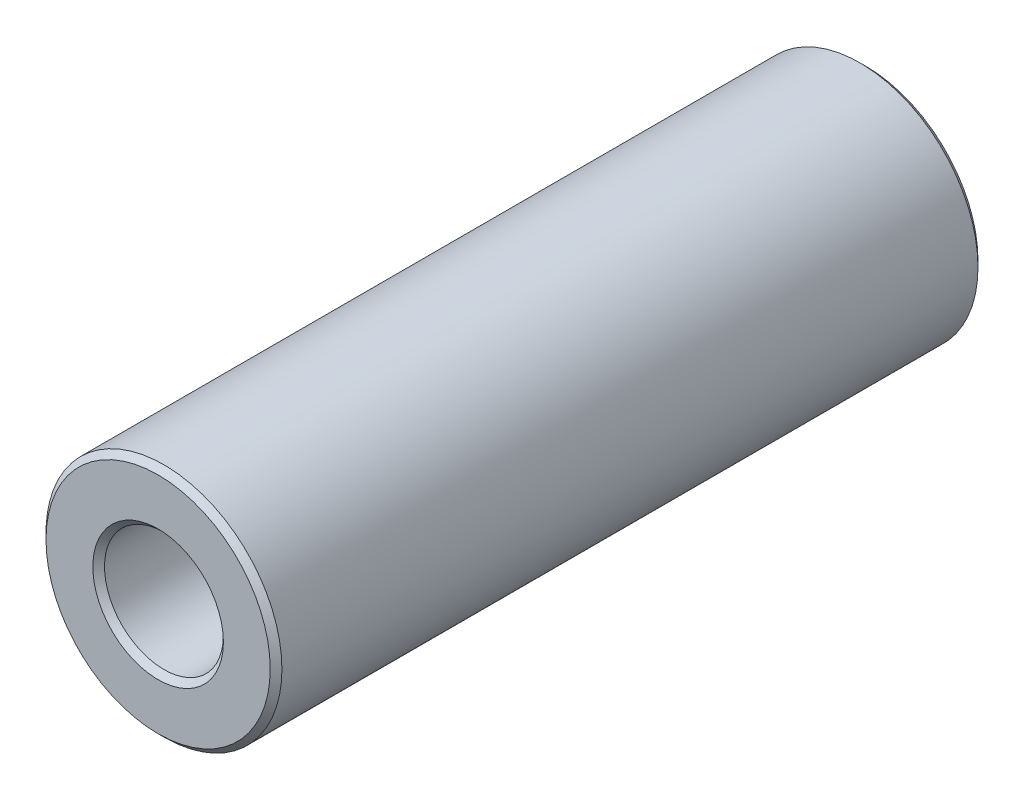
from build123d import *

# Parameters (mm, degrees)
BOSS_EXTRUDE1_DEPTH      = 19.05
BOSS_EXTRUDE1_DEPTH_BACK = 19.05
SKETCH3_R                = 6.35
SKETCH3_R_2              = 3.2004
CHAMFER1_SIZE            = 0.31496


with BuildPart() as part:
    # Sketch3 → Boss-Extrude1 (new, two sides: drawn at the far end of the back side and taken through both)
    with BuildSketch(Plane.XY.offset(-BOSS_EXTRUDE1_DEPTH_BACK)):
        Circle(SKETCH3_R)
        Circle(SKETCH3_R_2, mode=Mode.SUBTRACT)
    extrude(amount=BOSS_EXTRUDE1_DEPTH + BOSS_EXTRUDE1_DEPTH_BACK)

    # Chamfer1
    chamfer1_edges = [part.edges().sort_by_distance(p)[0] for p in [
        (-6.35, 0, -19.05),
        (-3.2004, 0, -19.05),
        (-6.35, 0, 19.05),
        (-3.2004, 0, 19.05),
    ]]
    chamfer(chamfer1_edges, length=CHAMFER1_SIZE)


solid = part.part
